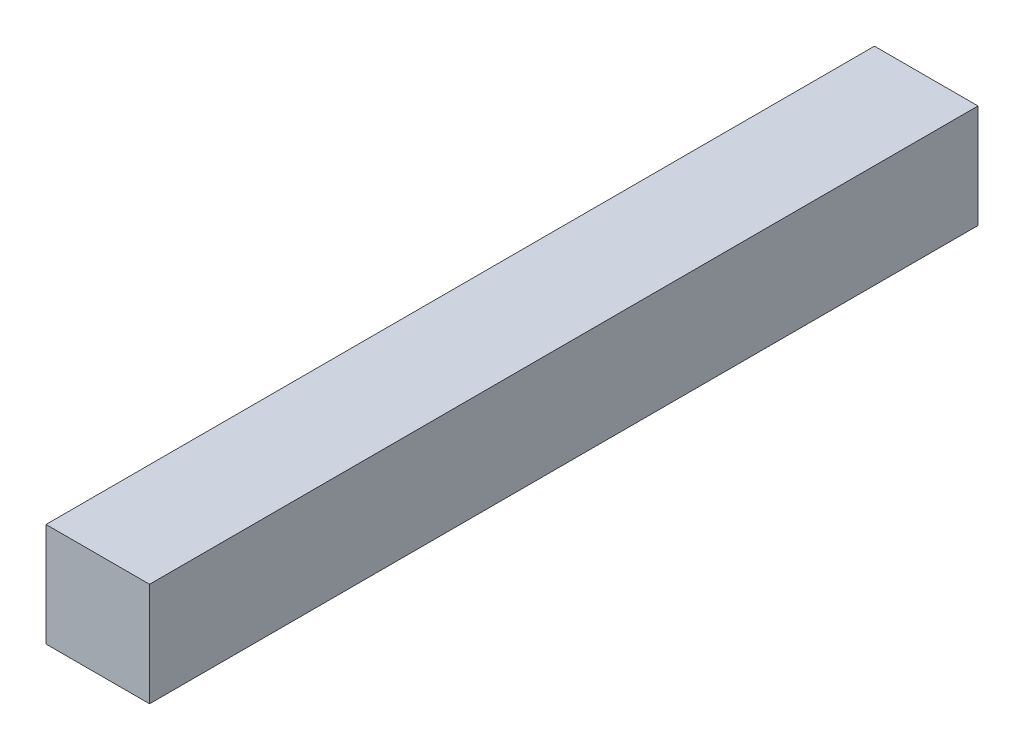
from build123d import *

# Parameters (mm, degrees)
SKETCH1_W           = 80000
SKETCH1_H           = 10000
BOSS_EXTRUDE1_DEPTH = 10000


with BuildPart() as part:
    # Sketch1 → Boss-Extrude1 (new body)
    with BuildSketch(Plane(origin=(0, 0, 0), x_dir=(0, 0, -1), z_dir=(1, 0, 0))):
        with Locations((0, 5000)):
            Rectangle(SKETCH1_W, SKETCH1_H)
    extrude(amount=BOSS_EXTRUDE1_DEPTH)


solid = part.part
